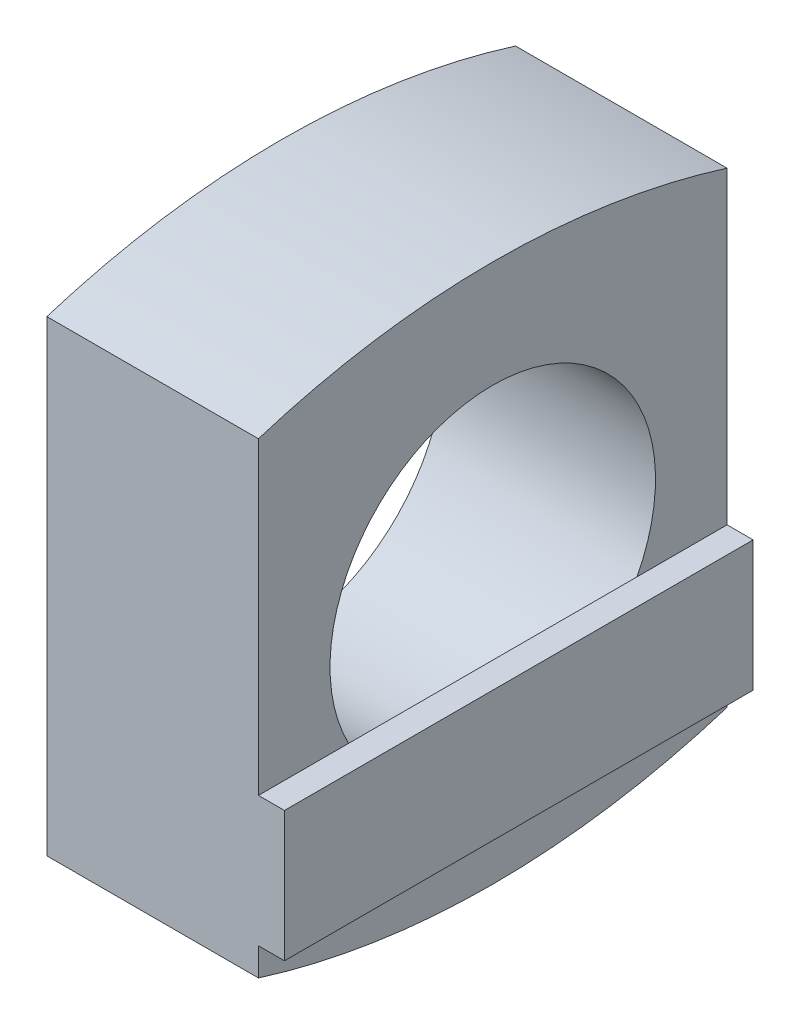
from build123d import *
from build123d.topology import SkipClean

# Parameters (mm, degrees)
BOSS_EXTRUDE1_DEPTH = 20.6375
CUT_EXTRUDE1_DEPTH  = 112.292933882
SKETCH3_W           = 45.72
SKETCH3_H           = 12.7
BOSS_EXTRUDE2_DEPTH = 2.54


with BuildPart() as part:
    # Sketch2 → Boss-Extrude1 (new body)
    with BuildSketch(Plane(origin=(0, 0, 0), x_dir=(0, 0, -1), z_dir=(1, 0, 0))):
        with BuildLine():
            Line((60.664128294, 0.938892053), (106.384128294, 0.938892053))
            Line((106.384128294, 0.938892053), (106.384128294, -21.840275095))
            ThreePointArc((106.384128294, -21.840275095), (83.524128294, -25.350107947), (60.664128294, -21.840275095))
            Line((60.664128294, -21.840275095), (60.664128294, 0.938892053))
        make_face()
    boss_extrude1 = extrude(amount=BOSS_EXTRUDE1_DEPTH)

    # Sketch2<5> → Cut-Extrude1 (cut, through all)
    with BuildSketch(Plane(origin=(0, 0, 0), x_dir=(0, 0, -1), z_dir=(1, 0, 0))):
        with BuildLine():
            Line((67.649128294, 0.938892053), (99.399128294, 0.938892053))
            ThreePointArc((99.399128294, 0.938892053), (83.524128294, -14.936107947), (67.649128294, 0.938892053))
        make_face()
    cut_extrude1 = extrude(amount=CUT_EXTRUDE1_DEPTH, mode=Mode.SUBTRACT)

    # Mirror4: Boss-Extrude1 across plane
    add(boss_extrude1.mirror(Plane(origin=(20.6375, 0.938892053, -60.664128294), x_dir=(0, 0, 1), z_dir=(0, 1, 0))))

    # Mirror5: Cut-Extrude1 across plane
    with SkipClean():  # the faces are left unmerged after this step: merging them gives an invalid solid
        add(cut_extrude1.mirror(Plane(origin=(20.6375, 0.938892053, -60.664128294), x_dir=(0, 0, 1), z_dir=(0, 1, 0))), mode=Mode.SUBTRACT)

    # Sketch3 → Boss-Extrude2 (add)
    with SkipClean():  # the faces are left unmerged after this step: merging them gives an invalid solid
        with BuildSketch(Plane(origin=(20.6375, 0, 0), x_dir=(0, 0, -1), z_dir=(1, 0, 0))):
            with Locations((83.524128294, -12.766104305)):
                Rectangle(SKETCH3_W, SKETCH3_H)
        extrude(amount=BOSS_EXTRUDE2_DEPTH)


solid = part.part
